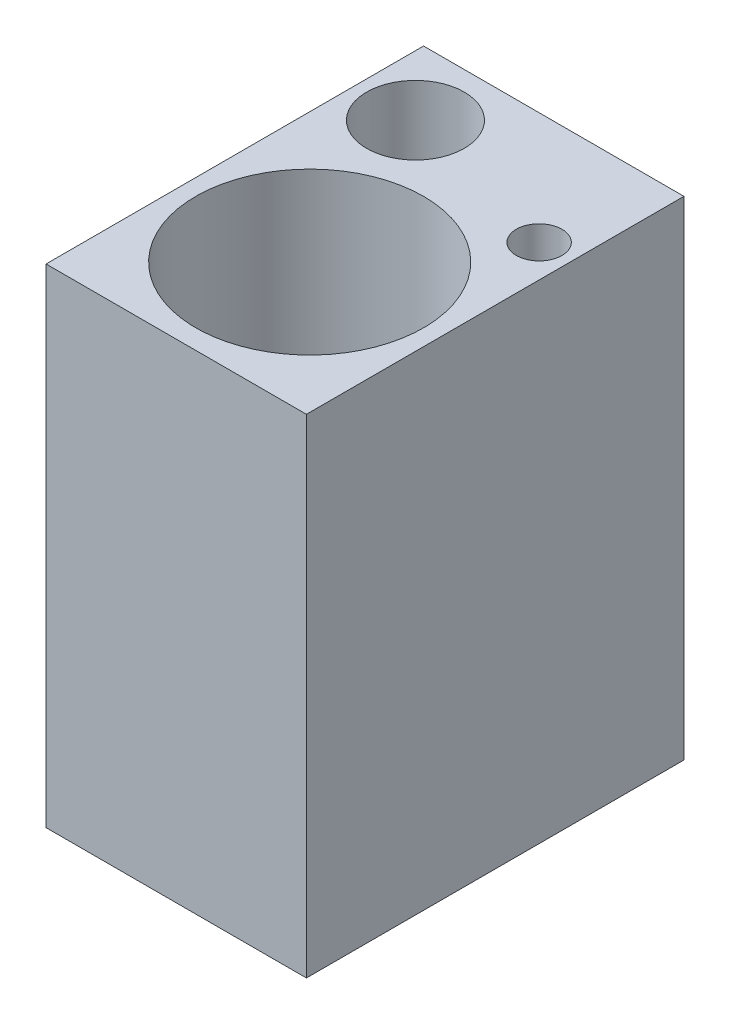
from build123d import *

# Parameters (mm, degrees)
CROQUIS1_W              = 16
CROQUIS1_H              = 23.2
CROQUIS1_R              = 7
CROQUIS1_R_2            = 3
CROQUIS1_R_3            = 1.4
SALIENTE_EXTRUIR1_DEPTH = 30


with BuildPart() as part:
    # Croquis1 → Saliente-Extruir1 (new body)
    with BuildSketch(Plane.XZ.offset(21.216878831)):
        with Locations((-34.53076768, 9.025)):
            Rectangle(CROQUIS1_W, CROQUIS1_H)
        with Locations((-34.53076768, 12.425)):
            Circle(CROQUIS1_R, mode=Mode.SUBTRACT)
        with Locations((-38.83076768, 1.625)):
            Circle(CROQUIS1_R_2, mode=Mode.SUBTRACT)
        with Locations((-28.53076768, 4.325)):
            Circle(CROQUIS1_R_3, mode=Mode.SUBTRACT)
    extrude(amount=-SALIENTE_EXTRUIR1_DEPTH)


solid = part.part
